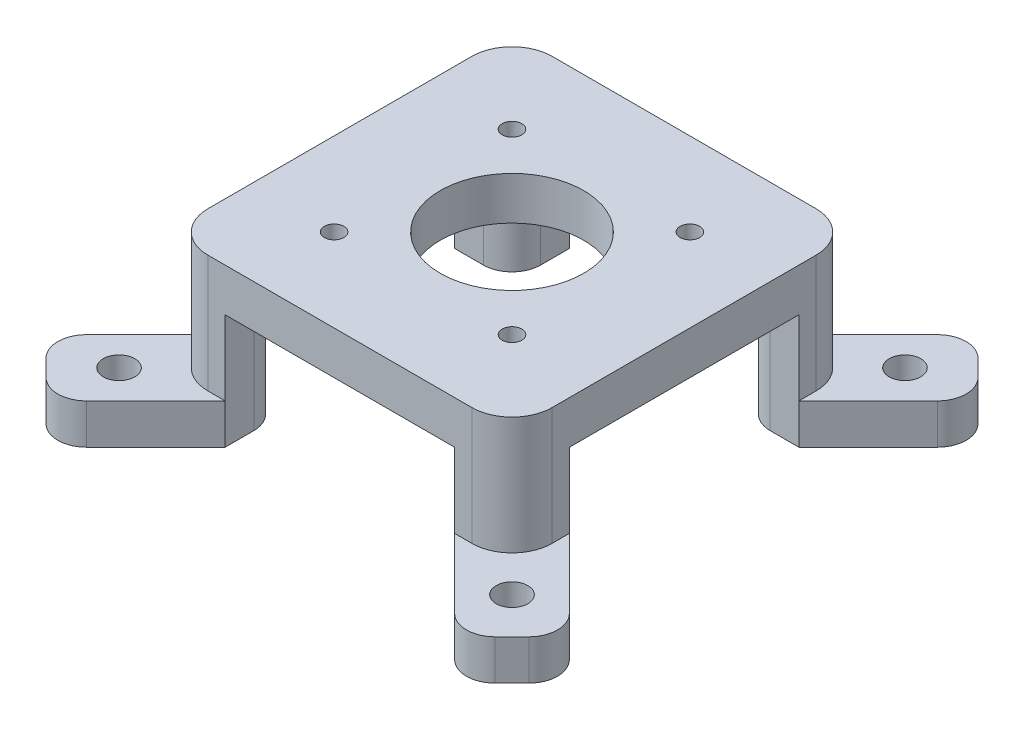
from build123d import *

# Parameters (mm, degrees)
SKETCH2_W           = 60
SKETCH2_H           = 60
SKETCH2_R           = 1.7
SKETCH2_R_2         = 12.5
BOSS_EXTRUDE2_DEPTH = 7.5
SKETCH3_W           = 10
SKETCH3_H           = 10
BOSS_EXTRUDE3_DEPTH = 20
BOSS_EXTRUDE5_DEPTH = 7
FILLET2_R           = 7
FILLET3_R           = 5
SKETCH7_R           = 2.75
CUT_EXTRUDE1_DEPTH  = 68.430967848


with BuildPart() as part:
    # Sketch2 → Boss-Extrude2 (new body)
    with BuildSketch(Plane(origin=(0, 0, 0), x_dir=(1, 0, 0), z_dir=(0, 1, 0))):
        Rectangle(SKETCH2_W, SKETCH2_H)
        with Locations(Location((-15.5, 15.5, 0), (0, 0, 270))):
            Circle(SKETCH2_R, mode=Mode.SUBTRACT)
        with Locations(Location((15.5, 15.5, 0), (0, 0, 90))):
            Circle(SKETCH2_R, mode=Mode.SUBTRACT)
        with Locations(Location((-15.5, -15.5, 0), (0, 0, 90))):
            Circle(SKETCH2_R, mode=Mode.SUBTRACT)
        with Locations(Location((15.5, -15.5, 0), (0, 0, 270))):
            Circle(SKETCH2_R, mode=Mode.SUBTRACT)
        with Locations(Location((0, 0, 0), (0, 0, 270))):
            Circle(SKETCH2_R_2, mode=Mode.SUBTRACT)
    extrude(amount=BOSS_EXTRUDE2_DEPTH)

    # Sketch3 → Boss-Extrude3 (add)
    with BuildSketch(Plane.XZ):
        with Locations((-25, 25)):
            Rectangle(SKETCH3_W, SKETCH3_H)
        with Locations((-25, -25)):
            Rectangle(SKETCH3_W, SKETCH3_H)
        with Locations((25, -25)):
            Rectangle(SKETCH3_W, SKETCH3_H)
        with Locations((25, 25)):
            Rectangle(SKETCH3_W, SKETCH3_H)
    extrude(amount=BOSS_EXTRUDE3_DEPTH)

    # Sketch5 → Boss-Extrude5 (add)
    with BuildSketch(Plane.XZ.offset(20)):
        with BuildLine():
            Line((20, -30), (32.071067812, -42.071067812))
            ThreePointArc((32.071067812, -42.071067812), (35.606601718, -43.535533906), (39.142135624, -42.071067812))
            Line((39.142135624, -42.071067812), (42.071067812, -39.142135624))
            ThreePointArc((42.071067812, -39.142135624), (43.535533906, -35.606601718), (42.071067812, -32.071067812))
            Line((42.071067812, -32.071067812), (30, -20))
            Line((30, -20), (20, -20))
            Line((20, -20), (20, -30))
        make_face()
        with BuildLine():
            Line((-20, -20), (-20, -30))
            Line((-20, -30), (-32.071067812, -42.071067812))
            ThreePointArc((-32.071067812, -42.071067812), (-35.606601718, -43.535533906), (-39.142135624, -42.071067812))
            Line((-39.142135624, -42.071067812), (-42.071067812, -39.142135624))
            ThreePointArc((-42.071067812, -39.142135624), (-43.535533906, -35.606601718), (-42.071067812, -32.071067812))
            Line((-42.071067812, -32.071067812), (-30, -20))
            Line((-30, -20), (-20, -20))
        make_face()
        with BuildLine():
            Line((20, 20), (20, 30))
            Line((20, 30), (32.071067812, 42.071067812))
            ThreePointArc((32.071067812, 42.071067812), (35.606601718, 43.535533906), (39.142135624, 42.071067812))
            Line((39.142135624, 42.071067812), (42.071067812, 39.142135624))
            ThreePointArc((42.071067812, 39.142135624), (43.535533906, 35.606601718), (42.071067812, 32.071067812))
            Line((42.071067812, 32.071067812), (30, 20))
            Line((30, 20), (20, 20))
        make_face()
        with BuildLine():
            Line((-20, 30), (-32.071067812, 42.071067812))
            ThreePointArc((-32.071067812, 42.071067812), (-35.606601718, 43.535533906), (-39.142135624, 42.071067812))
            Line((-39.142135624, 42.071067812), (-42.071067812, 39.142135624))
            ThreePointArc((-42.071067812, 39.142135624), (-43.535533906, 35.606601718), (-42.071067812, 32.071067812))
            Line((-42.071067812, 32.071067812), (-30, 20))
            Line((-30, 20), (-20, 20))
            Line((-20, 20), (-20, 30))
        make_face()
    extrude(amount=-BOSS_EXTRUDE5_DEPTH)

    # Fillet2
    fillet2_edges = [part.edges().sort_by_distance(p)[0] for p in [
        (30, -2.75, 30),
        (-30, -2.75, 30),
        (-30, -2.75, -30),
        (30, -2.75, -30),
    ]]
    fillet(fillet2_edges, radius=FILLET2_R)

    # Fillet3
    fillet3_edges = [part.edges().sort_by_distance(p)[0] for p in [
        (-20, -10, 20),
        (-20, -10, -20),
        (20, -10, -20),
        (20, -10, 20),
    ]]
    fillet(fillet3_edges, radius=FILLET3_R)

    # Sketch7 → Cut-Extrude1 (cut, through all)
    with BuildSketch(Plane.XZ.offset(20)):
        with Locations(Location((34.242640687, -34.242640687, 0), (0, 0, 270))):
            Circle(SKETCH7_R)
        with Locations(Location((-34.242640687, -34.242640687, 0), (0, 0, 270))):
            Circle(SKETCH7_R)
        with Locations(Location((-34.242640687, 34.242640687, 0), (0, 0, 270))):
            Circle(SKETCH7_R)
        with Locations(Location((34.242640687, 34.242640687, 0), (0, 0, 270))):
            Circle(SKETCH7_R)
    extrude(amount=-CUT_EXTRUDE1_DEPTH, mode=Mode.SUBTRACT)


solid = part.part
